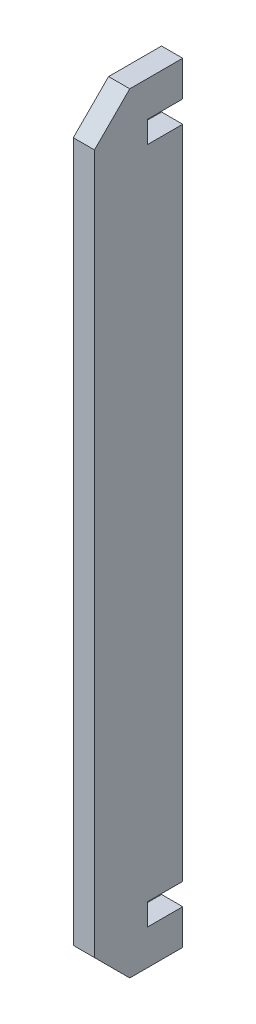
from build123d import *

# Parameters (mm, degrees)
SKETCH1_W           = 46.45
SKETCH1_H           = 5
BOSS_EXTRUDE1_DEPTH = 3
CHAMFER1_SIZE       = 5


with BuildPart() as part:
    # Sketch1 → Boss-Extrude1 (new body)
    with BuildSketch(Plane.YZ):
        Polygon((-21.021641791, 5.223880597), (-17.921641791, 5.223880597), (28.528358209, 5.223880597), (74.978358209, 5.223880597), (78.078358209, 5.223880597), (78.078358209, 0.223880597), (83.078358209, 0.223880597), (83.078358209, 12.723880597), (-26.021641791, 12.723880597), (-26.021641791, 0.223880597), (-21.021641791, 0.223880597), align=None)
        with Locations((5.303358209, 2.723880597)):
            Rectangle(SKETCH1_W, SKETCH1_H)
        with Locations((51.753358209, 2.723880597)):
            Rectangle(SKETCH1_W, SKETCH1_H)
    extrude(amount=BOSS_EXTRUDE1_DEPTH)

    # Chamfer1
    chamfer1_edges = [part.edges().sort_by_distance(p)[0] for p in [
        (1.5, -26.021641791, 12.723880597),
        (1.5, 83.078358209, 12.723880597),
    ]]
    chamfer(chamfer1_edges, length=CHAMFER1_SIZE)


solid = part.part
